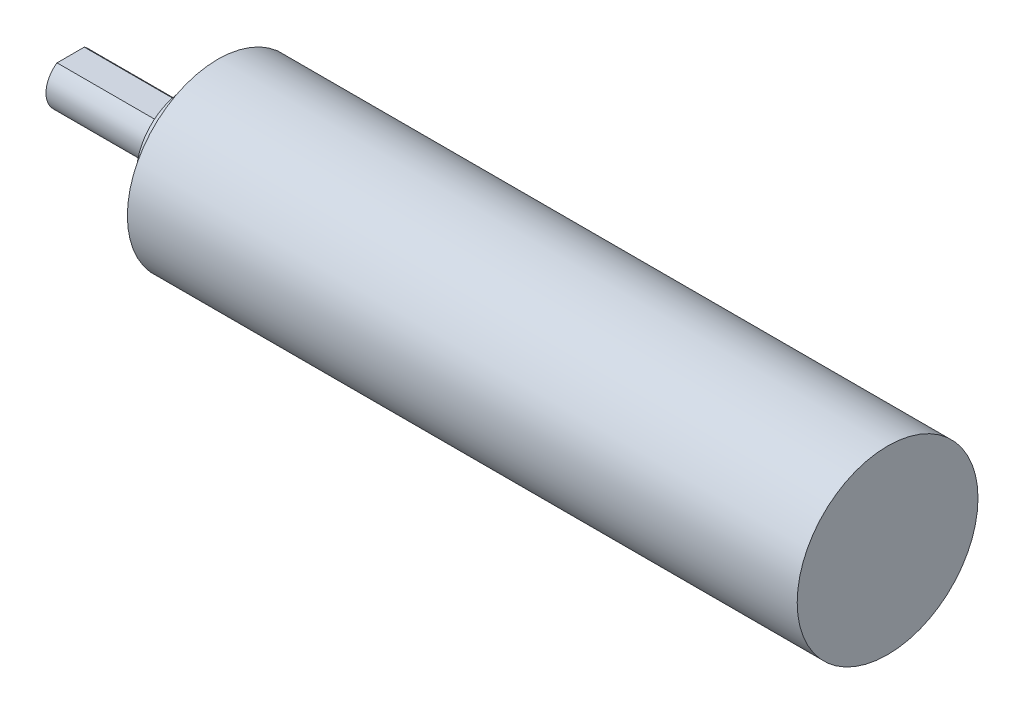
from build123d import *

# Parameters (mm, degrees)
M3X0_5_TAPPED_HOLE1_D     = 2.5
M3X0_5_TAPPED_HOLE1_DEPTH = 7.5
M3X0_5_TAPPED_HOLE1_TIP   = 0.751075774
CUT_EXTRUDE1_START        = -14
CUT_EXTRUDE1_DEPTH        = 14


with BuildPart() as part:
    # Sketch1 → Revolve1 (revolve)
    with BuildSketch(Plane.XY, mode=Mode.PRIVATE) as revolve1_sk:
        Polygon((0, 0), (0, 3), (14, 3), (14, 6), (17.9, 6), (17.9, 11), (99.4, 11), (99.4, 0), align=None)
    revolve(revolve1_sk.sketch.rotate(Axis((0, 0, 0), (1, 0, 0)), 90), axis=Axis((0, 0, 0), (1, 0, 0)))

    # M3x0.5 Tapped Hole1
    with Locations(Plane.ZY.offset(-17.9)):
        with Locations((-9, 0), (0, 9), (9, 0), (0, -9)):
            Hole(M3X0_5_TAPPED_HOLE1_D / 2, depth=M3X0_5_TAPPED_HOLE1_DEPTH)
            with Locations((0, 0, -(M3X0_5_TAPPED_HOLE1_DEPTH + M3X0_5_TAPPED_HOLE1_TIP / 2))):  # 118° drill point
                Cone(0, M3X0_5_TAPPED_HOLE1_D / 2, M3X0_5_TAPPED_HOLE1_TIP, mode=Mode.SUBTRACT)

    # Sketch4 → Cut-Extrude1 (cut)
    with BuildSketch(Plane.ZY.offset(CUT_EXTRUDE1_START)):
        with BuildLine():
            Line((-1.658312395, 2.5), (1.658312395, 2.5))
            ThreePointArc((1.658312395, 2.5), (0, 3), (-1.658312395, 2.5))
        make_face()
    extrude(amount=CUT_EXTRUDE1_DEPTH, mode=Mode.SUBTRACT)


solid = part.part
